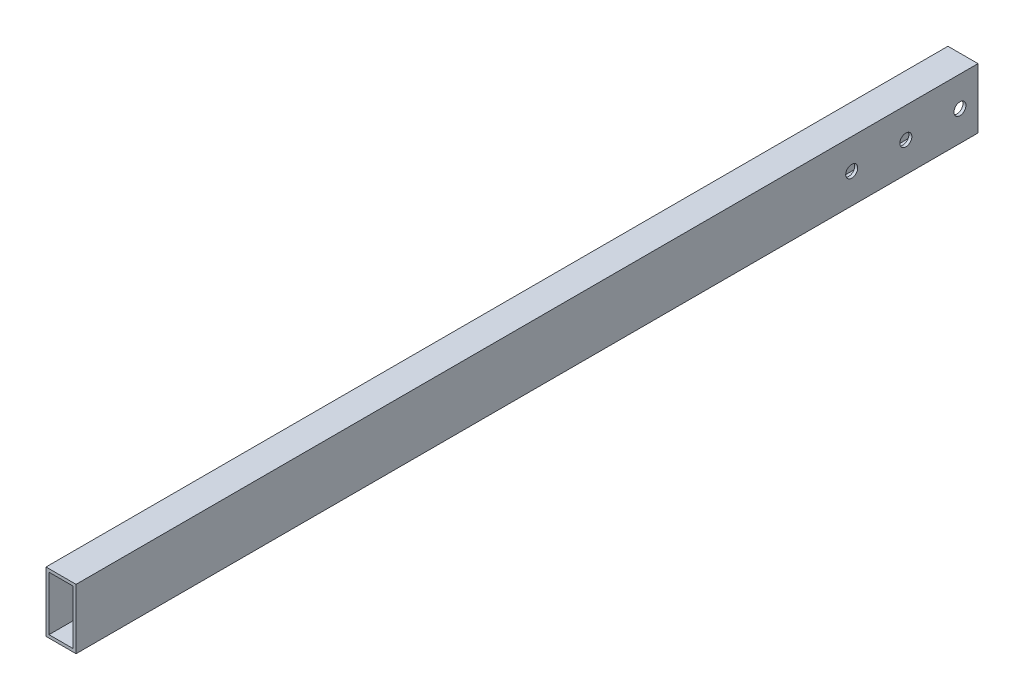
from build123d import *

# Parameters (mm, degrees)
SKETCH1_W           = 10
SKETCH1_H           = 20
SKETCH1_W_2         = 8
SKETCH1_H_2         = 18
BOSS_EXTRUDE1_DEPTH = 300
CUT_EXTRUDE1_REACH  = 302.333
SKETCH2_R           = 2


with BuildPart() as part:
    # Sketch1 → Boss-Extrude1 (new body)
    with BuildSketch(Plane.XY):
        Rectangle(SKETCH1_W, SKETCH1_H)
        Rectangle(SKETCH1_W_2, SKETCH1_H_2, mode=Mode.SUBTRACT)
    extrude(amount=BOSS_EXTRUDE1_DEPTH)

    # Sketch2 → Cut-Extrude1 (cut, up to next)
    with BuildSketch(Plane(origin=(5, 0, 0), x_dir=(0, 0, -1), z_dir=(1, 0, 0)), mode=Mode.PRIVATE) as cut_extrude1_sk1:
        with Locations((-6, 0)):
            Circle(SKETCH2_R)
    cut_extrude1_tool1 = extrude(cut_extrude1_sk1.sketch, amount=-CUT_EXTRUDE1_REACH, mode=Mode.PRIVATE) & part.part
    # Sketch2 → Cut-Extrude1 (cut, up to next)
    with BuildSketch(Plane(origin=(5, 0, 0), x_dir=(0, 0, -1), z_dir=(1, 0, 0)), mode=Mode.PRIVATE) as cut_extrude1_sk2:
        with Locations((-24, 0)):
            Circle(SKETCH2_R)
    cut_extrude1_tool2 = extrude(cut_extrude1_sk2.sketch, amount=-CUT_EXTRUDE1_REACH, mode=Mode.PRIVATE) & part.part
    # Sketch2 → Cut-Extrude1 (cut, up to next)
    with BuildSketch(Plane(origin=(5, 0, 0), x_dir=(0, 0, -1), z_dir=(1, 0, 0)), mode=Mode.PRIVATE) as cut_extrude1_sk3:
        with Locations((-42, 0)):
            Circle(SKETCH2_R)
    cut_extrude1_tool3 = extrude(cut_extrude1_sk3.sketch, amount=-CUT_EXTRUDE1_REACH, mode=Mode.PRIVATE) & part.part
    add(cut_extrude1_tool1.solids().sort_by_distance((5, 0, 6))[0], mode=Mode.SUBTRACT)
    add(cut_extrude1_tool2.solids().sort_by_distance((5, 0, 24))[0], mode=Mode.SUBTRACT)
    add(cut_extrude1_tool3.solids().sort_by_distance((5, 0, 42))[0], mode=Mode.SUBTRACT)


solid = part.part
